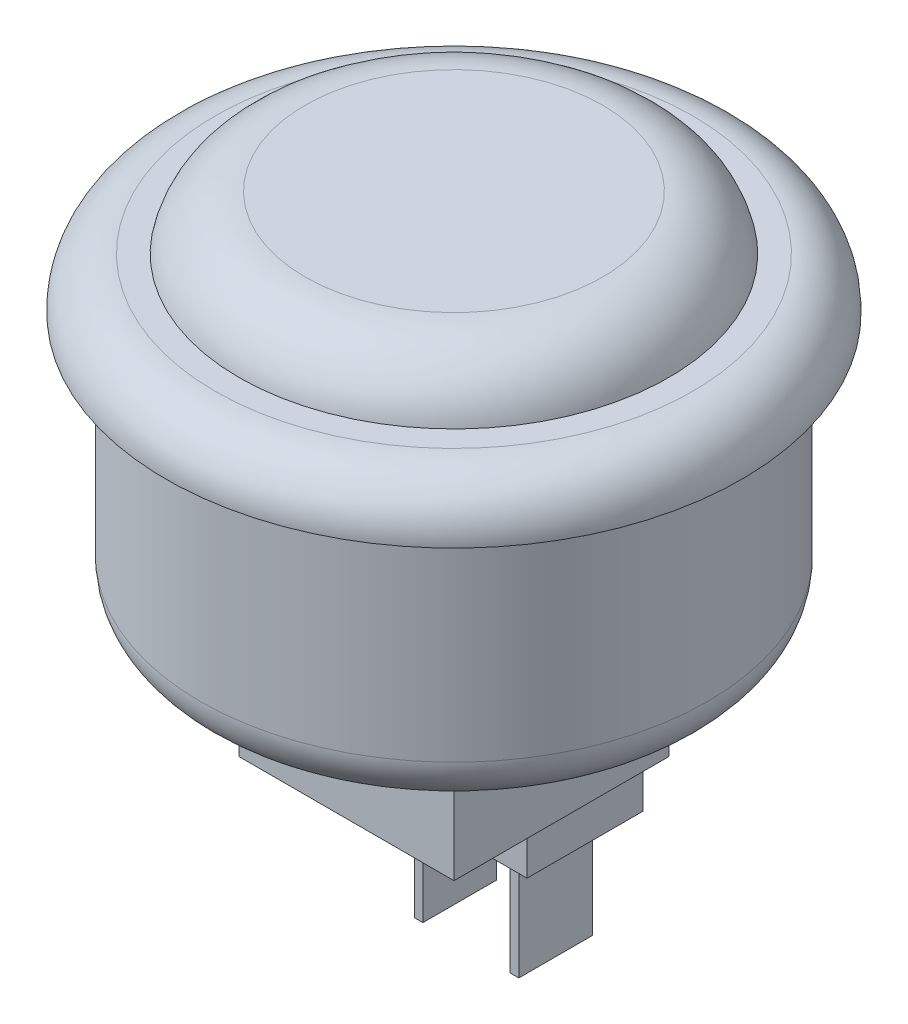
from build123d import *

# Parameters (mm, degrees)
CROQUIS3_W              = 12.5
CROQUIS3_H              = 12.5
SALIENTE_EXTRUIR1_DEPTH = 7.35
CROQUIS4_W              = 10.5
CROQUIS4_H              = 6.75
SALIENTE_EXTRUIR2_DEPTH = 3
CROQUIS5_W              = 0.5
CROQUIS5_H              = 4.284238858
SALIENTE_EXTRUIR3_DEPTH = 7


with BuildPart() as part:
    # Croquis2 → Revolución1 (revolve)
    with BuildSketch(Plane.XY, mode=Mode.PRIVATE) as revoluci_n1_sk:
        with BuildLine():
            Line((0, 3.679432079), (-8.659361316, 3.679432079))
            ThreePointArc((-8.659361316, 3.679432079), (-11.14229204, 2.791903832), (-12.5, 0.531532079))
            Line((-12.5, 0.531532079), (-13.888119122, 0.531532079))
            ThreePointArc((-13.888119122, 0.531532079), (-15.961182203, -0.355908417), (-16.75, -2.468467921))
            Line((-16.75, -2.468467921), (-14.75, -2.468467921))
            Line((-14.75, -2.468467921), (-14.75, -14.670168674))
            ThreePointArc((-14.75, -14.670168674), (-13.930397127, -16.648865047), (-11.951700754, -17.468467921))
            Line((-11.951700754, -17.468467921), (0, -17.468467921))
            Line((0, -17.468467921), (0, 3.679432079))
        make_face()
    revolve(revoluci_n1_sk.sketch.rotate(Axis((0, 0, 0), (0, 1, 0)), 270), axis=Axis((0, 0, 0), (0, 1, 0)))

    # Croquis3 → Saliente-Extruir1 (add)
    with BuildSketch(Plane.XZ.offset(17.468467921)):
        Rectangle(CROQUIS3_W, CROQUIS3_H)
    extrude(amount=SALIENTE_EXTRUIR1_DEPTH)

    # Croquis4 → Saliente-Extruir2 (add)
    with BuildSketch(Plane(origin=(0, -24.818467921, 0), x_dir=(-1, 0, 0), z_dir=(0, -1, 0))):
        with Locations((0, 2.375)):
            Rectangle(CROQUIS4_W, CROQUIS4_H)
    extrude(amount=SALIENTE_EXTRUIR2_DEPTH)

    # Croquis5 → Saliente-Extruir3 (add)
    with BuildSketch(Plane.XZ.offset(27.818467921)):
        with Locations((-2.79, -2.875)):
            Rectangle(CROQUIS5_W, CROQUIS5_H)
    saliente_extruir3 = extrude(amount=SALIENTE_EXTRUIR3_DEPTH)

    # Simetría1: Saliente-Extruir3 across plane
    add(saliente_extruir3.mirror(Plane(origin=(0, 0, 0), x_dir=(0, 0, 1), z_dir=(1, 0, 0))))


solid = part.part
